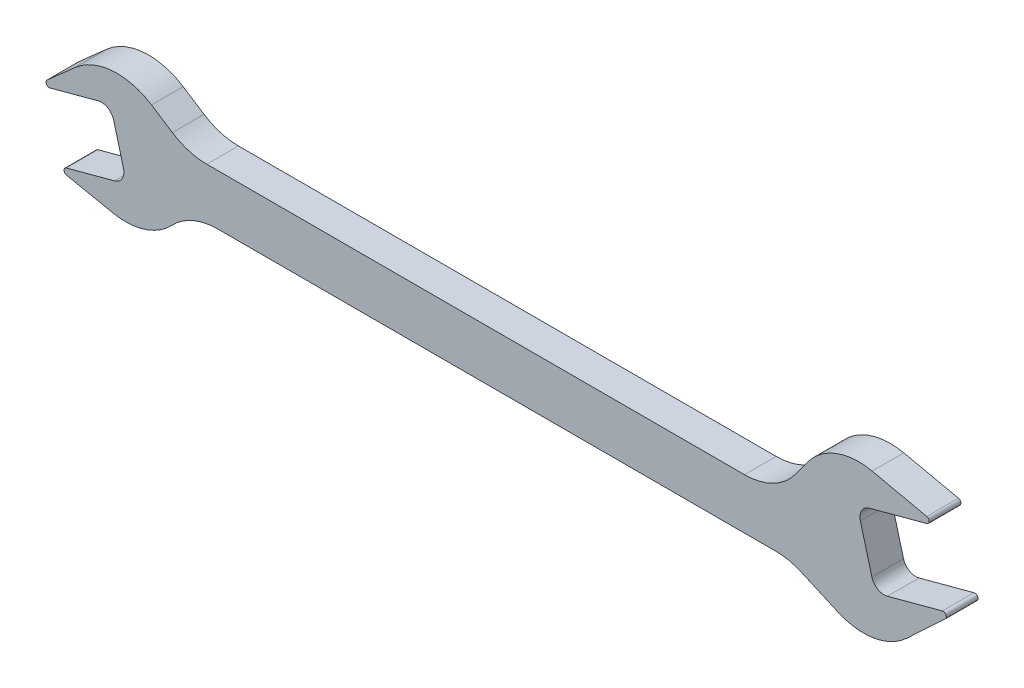
from build123d import *

# Parameters (mm, degrees)
AUFSATZ_LINEAR_AUSTRAGEN1_DEPTH = 2.5
VERRUNDUNG1_R                   = 10
VERRUNDUNG2_R                   = 10
VERRUNDUNG3_R                   = 2
VERRUNDUNG4_R                   = 0.5
VERRUNDUNG5_R                   = 10


with BuildPart() as part:
    # Skizze1 → Aufsatz-Linear austragen1 (new, symmetric)
    with BuildSketch(Plane.XY):
        Polygon((46.512935857, 2.5), (55.211178367, 14.470305023), (72.222811922, 10.746349053), (59.213582381, 7.260536503), (62.060591877, -3.364647586), (74.617627619, 0), (62.199292585, -11.609692287), (48.474059835, -5.5), (-46.512935857, -5.5), (-52.459487047, -12.797272415), (-67.79418193, -9.659258263), (-56.203072015, -6.553429722), (-58.791262466, 3.105828541), (-70.382372381, 0), (-58.671144129, 10.384947415), (-46.512935857, 2.5), align=None)
    extrude(amount=AUFSATZ_LINEAR_AUSTRAGEN1_DEPTH, both=True)

    # Verrundung1
    verrundung1_edges = [part.edges().sort_by_distance(p)[0] for p in [
        (-52.459487047, -12.797272415, 0),
        (-58.671144129, 10.384947415, 0),
    ]]
    fillet(verrundung1_edges, radius=VERRUNDUNG1_R)

    # Verrundung2
    verrundung2_edges = [part.edges().sort_by_distance(p)[0] for p in [
        (62.199292585, -11.609692287, 0),
        (55.211178367, 14.470305023, 0),
    ]]
    fillet(verrundung2_edges, radius=VERRUNDUNG2_R)

    # Verrundung3
    verrundung3_edges = [part.edges().sort_by_distance(p)[0] for p in [
        (59.213582381, 7.260536503, 0),
        (62.060591877, -3.364647586, 0),
        (-56.203072015, -6.553429722, 0),
        (-58.791262466, 3.105828541, 0),
    ]]
    fillet(verrundung3_edges, radius=VERRUNDUNG3_R)

    # Verrundung4
    verrundung4_edges = [part.edges().sort_by_distance(p)[0] for p in [
        (72.222811922, 10.746349053, 0),
        (74.617627619, 0, 0),
        (-67.79418193, -9.659258263, 0),
        (-70.382372381, 0, 0),
    ]]
    fillet(verrundung4_edges, radius=VERRUNDUNG4_R)

    # Verrundung5
    verrundung5_edges = [part.edges().sort_by_distance(p)[0] for p in [
        (46.512935857, 2.5, 0),
        (48.474059835, -5.5, 0),
        (-46.512935857, -5.5, 0),
        (-46.512935857, 2.5, 0),
    ]]
    fillet(verrundung5_edges, radius=VERRUNDUNG5_R)


solid = part.part
